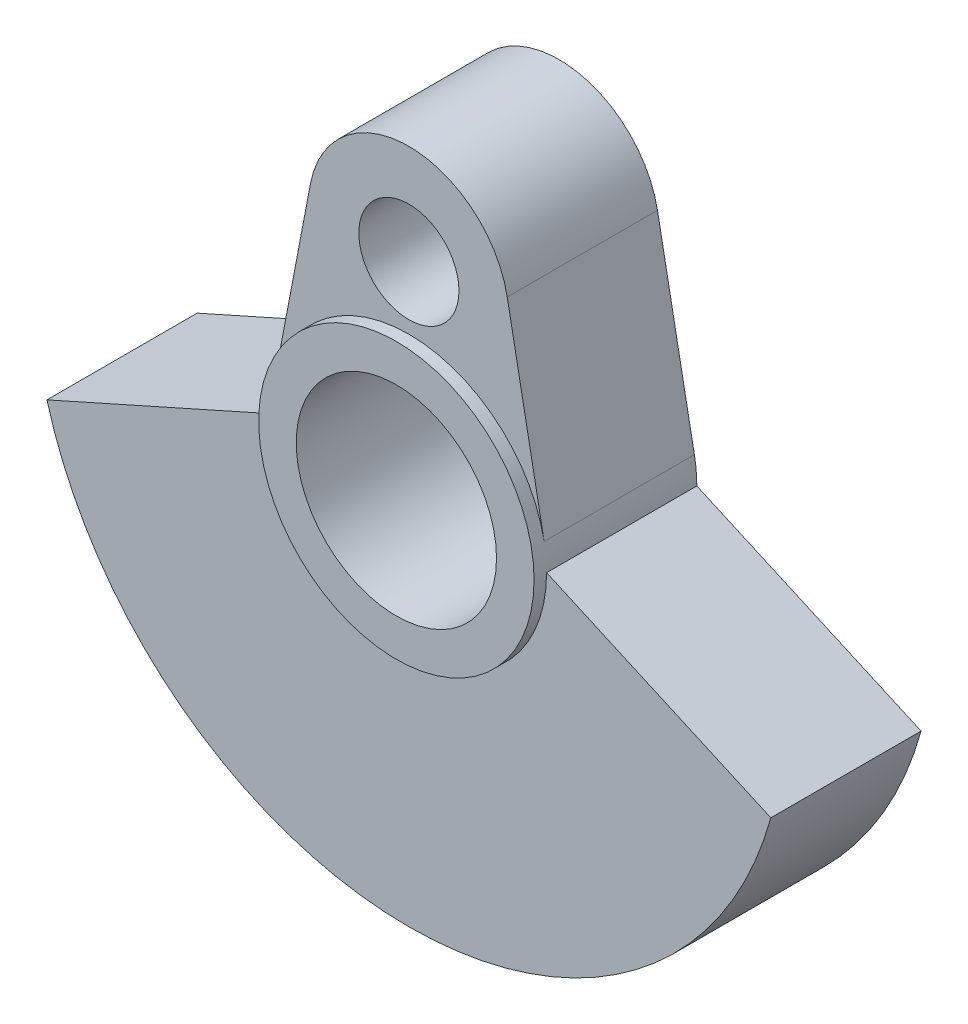
from build123d import *

# Parameters (mm, degrees)
BOSS_EXTRUDE1_DEPTH   = 3
SKETCH1_R             = 2
BOSS_EXTRUDE1_2_DEPTH = 3
BOSS_EXTRUDE3_START   = 3.5
SKETCH1_4_R           = 5.5
SKETCH1_4_R_2         = 4
BOSS_EXTRUDE3_DEPTH   = 3.5
SKETCH1_5_R           = 5.5
SKETCH1_5_R_2         = 4
BOSS_EXTRUDE4_DEPTH   = 3


with BuildPart() as part:
    # Sketch1 → Boss-Extrude1 (new, symmetric)
    with BuildSketch(Plane.XY):
        with BuildLine():
            Line((-5.5, 0), (-14.456832295, -4))
            ThreePointArc((-14.456832295, -4), (0, -15), (14.456832295, -4))
            Line((14.456832295, -4), (5.5, 0))
            ThreePointArc((5.5, 0), (0, -5.5), (-5.5, 0))
        make_face()
    extrude(amount=BOSS_EXTRUDE1_DEPTH, both=True)



with BuildPart() as body_2:
    # Sketch1 → Boss-Extrude1 2 (new, symmetric)
    with BuildSketch(Plane.XY):
        with BuildLine():
            Line((-3.929058411, 8.75), (-5.402455316, 1.03125))
            ThreePointArc((-5.402455316, 1.03125), (0, 5.5), (5.402455316, 1.03125))
            Line((5.402455316, 1.03125), (3.929058411, 8.75))
            ThreePointArc((3.929058411, 8.75), (0, 12), (-3.929058411, 8.75))
        make_face()
        with Locations((0, 8)):
            Circle(SKETCH1_R, mode=Mode.SUBTRACT)
    extrude(amount=BOSS_EXTRUDE1_2_DEPTH, both=True)


with BuildPart() as part_1:
    add(part.part)

    add(body_2.part)  # Boss-Extrude3 merges body 2
    # Sketch1<4> → Boss-Extrude3 (add)
    with BuildSketch(Plane.XY.offset(BOSS_EXTRUDE3_START)):
        Circle(SKETCH1_4_R)
        Circle(SKETCH1_4_R_2, mode=Mode.SUBTRACT)
    extrude(amount=-BOSS_EXTRUDE3_DEPTH)

    # Sketch1<5> → Boss-Extrude4 (add)
    with BuildSketch(Plane.XY):
        Circle(SKETCH1_5_R)
        Circle(SKETCH1_5_R_2, mode=Mode.SUBTRACT)
    extrude(amount=-BOSS_EXTRUDE4_DEPTH)


solid = part_1.part
